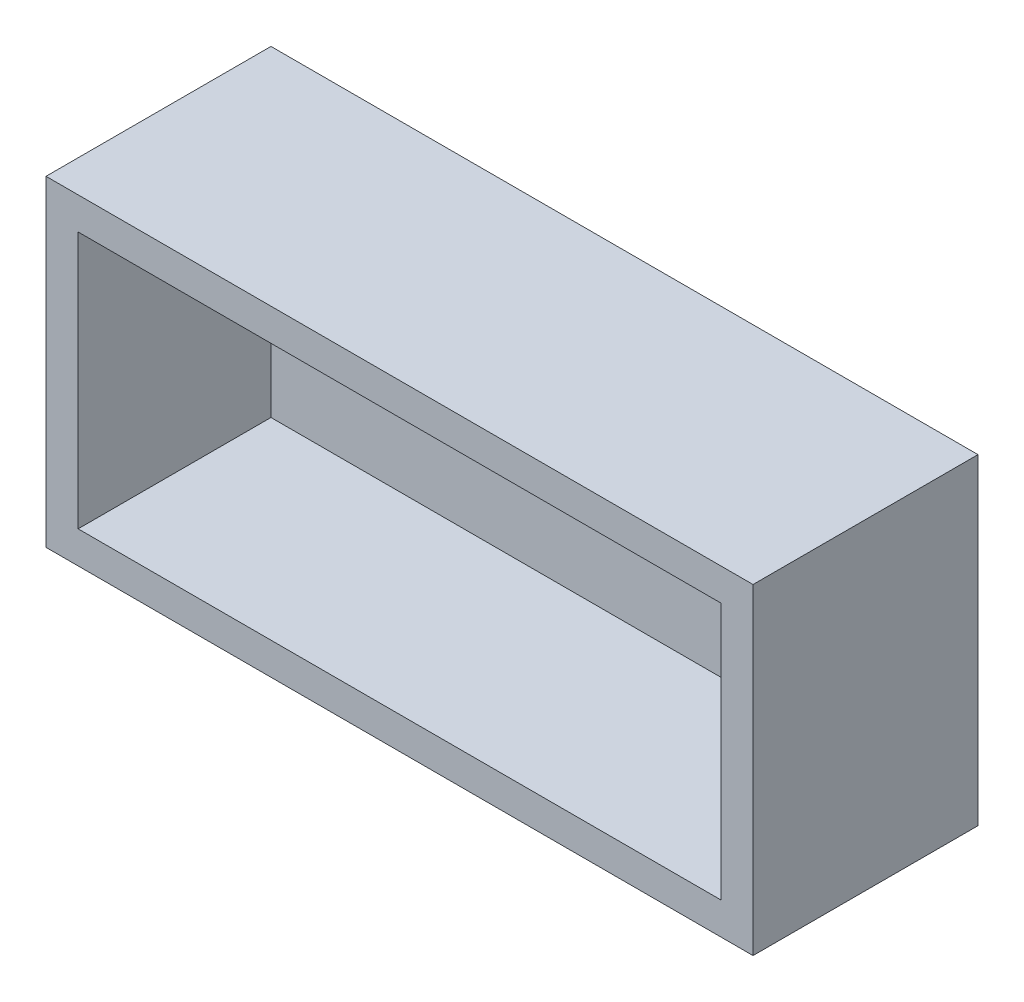
from build123d import *

# Parameters (mm, degrees)
CROQUIS1_W              = 33
CROQUIS1_H              = 15
CROQUIS1_W_2            = 30
CROQUIS1_H_2            = 12
SALIENTE_EXTRUIR1_DEPTH = 9
CROQUIS2_W              = 33
CROQUIS2_H              = 15
SALIENTE_EXTRUIR2_DEPTH = 1.5
CROQUIS3_R              = 1
CORTAR_EXTRUIR1_DEPTH   = 1.5


with BuildPart() as part:
    # Croquis1 → Saliente-Extruir1 (new body)
    with BuildSketch(Plane.XY):
        with Locations((-37.090098455, 21.435354346)):
            Rectangle(CROQUIS1_W, CROQUIS1_H)
        with Locations((-37.090098455, 21.435354346)):
            Rectangle(CROQUIS1_W_2, CROQUIS1_H_2, mode=Mode.SUBTRACT)
    extrude(amount=SALIENTE_EXTRUIR1_DEPTH)

    # Croquis2 → Saliente-Extruir2 (add)
    with BuildSketch(Plane.XY):
        with Locations((-37.090098455, 21.435354346)):
            Rectangle(CROQUIS2_W, CROQUIS2_H)
    extrude(amount=-SALIENTE_EXTRUIR2_DEPTH)

    # Croquis3 → Cortar-Extruir1 (cut)
    with BuildSketch(Plane.XY):
        with Locations((-37.090098455, 21.435354346)):
            Circle(CROQUIS3_R)
    extrude(amount=-CORTAR_EXTRUIR1_DEPTH, mode=Mode.SUBTRACT)


solid = part.part
